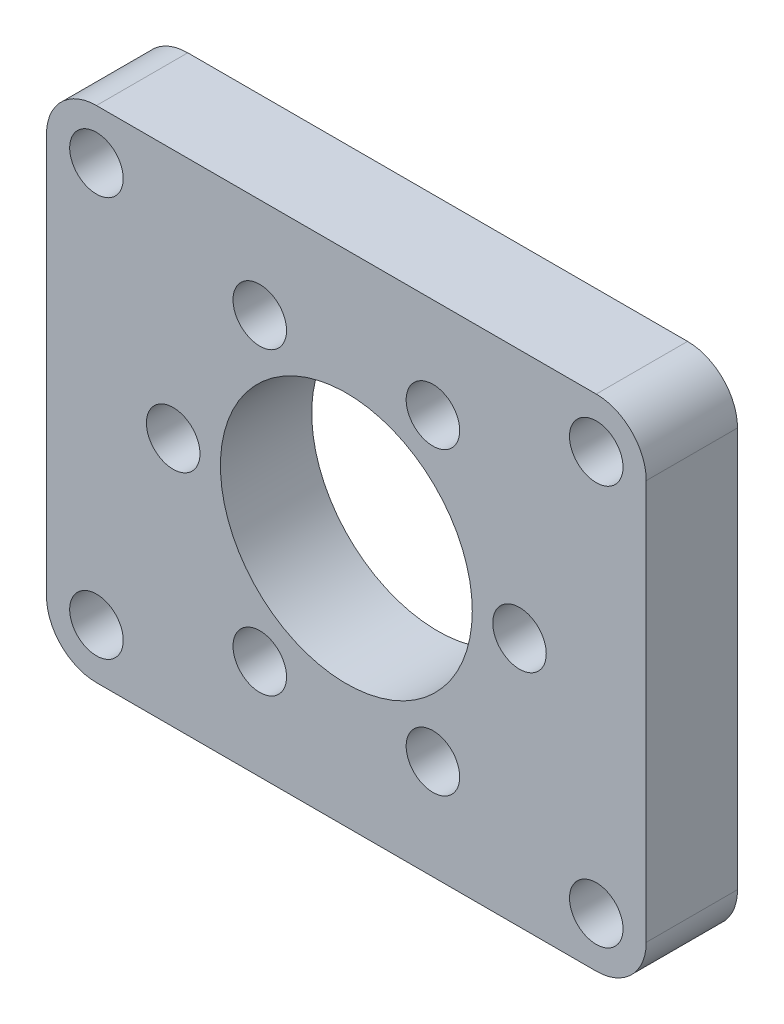
from build123d import *

# Parameters (mm, degrees)
SKETCH1_W                = 38.1
SKETCH1_H                = 31.75
BOSS_EXTRUDE1_DEPTH      = 5.8
SKETCH2_R                = 8
CUT_EXTRUDE1_DEPTH       = 50.933080217
M3_CLEARANCE_HOLE1_D     = 3.4
M3_CLEARANCE_HOLE1_DEPTH = 6.35
M3_CLEARANCE_HOLE1_TIP   = 1.021463052
M3_CLEARANCE_HOLE2_D     = 3.4
M3_CLEARANCE_HOLE2_DEPTH = 6.35
M3_CLEARANCE_HOLE2_TIP   = 1.021463052
FILLET1_R                = 3.175


with BuildPart() as part:
    # Sketch1 → Boss-Extrude1 (new body)
    with BuildSketch(Plane.XY):
        with Locations((19.05, 15.875)):
            Rectangle(SKETCH1_W, SKETCH1_H)
    extrude(amount=BOSS_EXTRUDE1_DEPTH)

    # Sketch2 → Cut-Extrude1 (cut, through all)
    with BuildSketch(Plane.XY.offset(5.8)):
        with Locations((19.05, 15.875)):
            Circle(SKETCH2_R)
    extrude(amount=-CUT_EXTRUDE1_DEPTH, mode=Mode.SUBTRACT)

    # M3 Clearance Hole1
    with Locations(Plane.XY.offset(5.8)):
        with Locations((30.05, 15.875), (24.55, 25.401279442), (13.55, 25.401279442), (8.05, 15.875), (13.55, 6.348720558), (24.55, 6.348720558)):
            Hole(M3_CLEARANCE_HOLE1_D / 2, depth=M3_CLEARANCE_HOLE1_DEPTH)
            with Locations((0, 0, -(M3_CLEARANCE_HOLE1_DEPTH + M3_CLEARANCE_HOLE1_TIP / 2))):  # 118° drill point
                Cone(0, M3_CLEARANCE_HOLE1_D / 2, M3_CLEARANCE_HOLE1_TIP, mode=Mode.SUBTRACT)

    # M3 Clearance Hole2
    with Locations(Plane.XY.offset(5.8)):
        with Locations((3.175, 28.575), (34.925, 28.575), (34.925, 3.175), (3.175, 3.175)):
            Hole(M3_CLEARANCE_HOLE2_D / 2, depth=M3_CLEARANCE_HOLE2_DEPTH)
            with Locations((0, 0, -(M3_CLEARANCE_HOLE2_DEPTH + M3_CLEARANCE_HOLE2_TIP / 2))):  # 118° drill point
                Cone(0, M3_CLEARANCE_HOLE2_D / 2, M3_CLEARANCE_HOLE2_TIP, mode=Mode.SUBTRACT)

    # Fillet1
    fillet1_edges = [part.edges().sort_by_distance(p)[0] for p in [
        (0, 31.75, 2.9),
        (38.1, 31.75, 2.9),
        (38.1, 0, 2.9),
        (0, 0, 2.9),
    ]]
    fillet(fillet1_edges, radius=FILLET1_R)


solid = part.part
